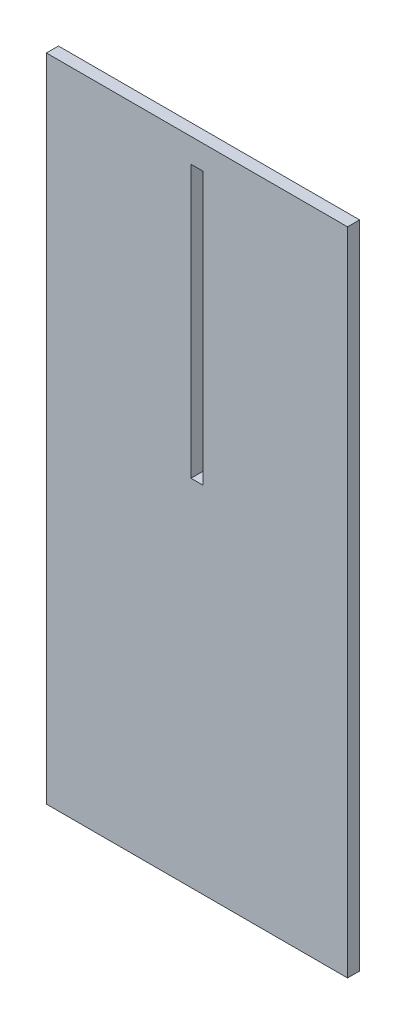
from build123d import *

# Parameters (mm, degrees)
SKETCH2_W           = 125
SKETCH2_H           = 270
SKETCH2_W_2         = 5
SKETCH2_H_2         = 112.865850887
BOSS_EXTRUDE2_DEPTH = 5


with BuildPart() as part:
    # Sketch2 → Boss-Extrude2 (new body)
    with BuildSketch(Plane.XY):
        with Locations((62.5, -135)):
            Rectangle(SKETCH2_W, SKETCH2_H)
        with Locations((62.5, -66.432925444)):
            Rectangle(SKETCH2_W_2, SKETCH2_H_2, mode=Mode.SUBTRACT)
    extrude(amount=BOSS_EXTRUDE2_DEPTH)


solid = part.part
